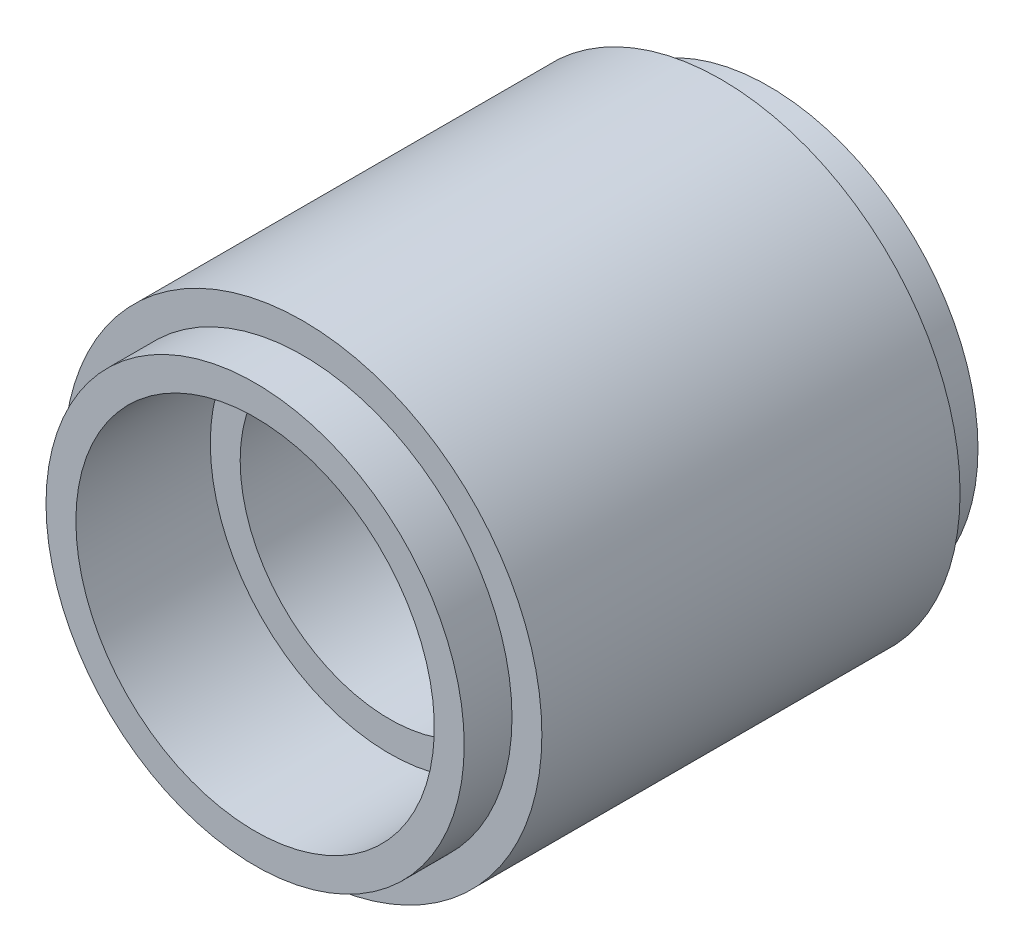
from build123d import *


with BuildPart() as part:
    # Sketch1 → Revolve1 (revolve)
    with BuildSketch(Plane(origin=(0, 0, 0), x_dir=(0, 0, -1), z_dir=(1, 0, 0)), mode=Mode.PRIVATE) as revolve1_sk:
        Polygon((-11.1125, 12.7), (11.1125, 12.7), (11.1125, 11.1125), (13.6525, 11.1125), (13.6525, 9.525), (6.50875, 9.525), (6.50875, 7.9375), (-6.50875, 7.9375), (-6.50875, 9.525), (-13.6525, 9.525), (-13.6525, 11.1125), (-11.1125, 11.1125), align=None)
    revolve(revolve1_sk.sketch.rotate(Axis((0, 0, -12.18326746), (0, 0, 1)), 90), axis=Axis((0, 0, -12.18326746), (0, 0, 1)))


solid = part.part
